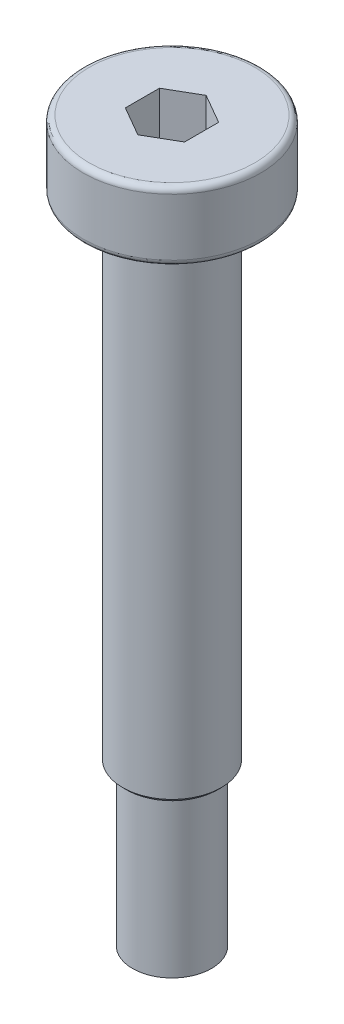
from build123d import *

# Parameters (mm, degrees)
FILLET_1_R          = 0.3
CUT_EXTRUDE_1_DEPTH = 2.4
CHAMFER_1_SIZE      = 0.2


with BuildPart() as part:
    # 草图1 → 旋转1 (revolve)
    with BuildSketch(Plane.XY, mode=Mode.PRIVATE) as revolve_1_sk:
        Polygon((0, 9.61644491), (-4.5, 9.61644491), (-4.5, 6.11644491), (-2.5, 6.11644491), (-2.5, -18.88355509), (-2, -18.88355509), (-2, -26.88355509), (0, -26.88355509), align=None)
    revolve(revolve_1_sk.sketch.rotate(Axis((0, 13.292915498, 0), (0, -1, 0)), 270), axis=Axis((0, 13.292915498, 0), (0, -1, 0)))

    # 圆角1
    fillet_1_edges = [part.edges().sort_by_distance(p)[0] for p in [
        (0, 6.11644491, -4.5),
        (0, 9.61644491, -4.5),
    ]]
    fillet(fillet_1_edges, radius=FILLET_1_R)

    # 草图2 → 切除-拉伸1 (cut)
    with BuildSketch(Plane(origin=(0, 9.61644491, 0), x_dir=(1, 0, 0), z_dir=(0, 1, 0))):
        Polygon((1.5, 0.866025404), (0, 1.732050808), (-1.5, 0.866025404), (-1.5, -0.866025404), (0, -1.732050808), (1.5, -0.866025404), align=None)
    extrude(amount=-CUT_EXTRUDE_1_DEPTH, mode=Mode.SUBTRACT)

    # 倒角1
    chamfer_1_edges = [part.edges().sort_by_distance(p)[0] for p in [
        (0, -18.88355509, -2.5),
    ]]
    chamfer(chamfer_1_edges, length=CHAMFER_1_SIZE)


solid = part.part
